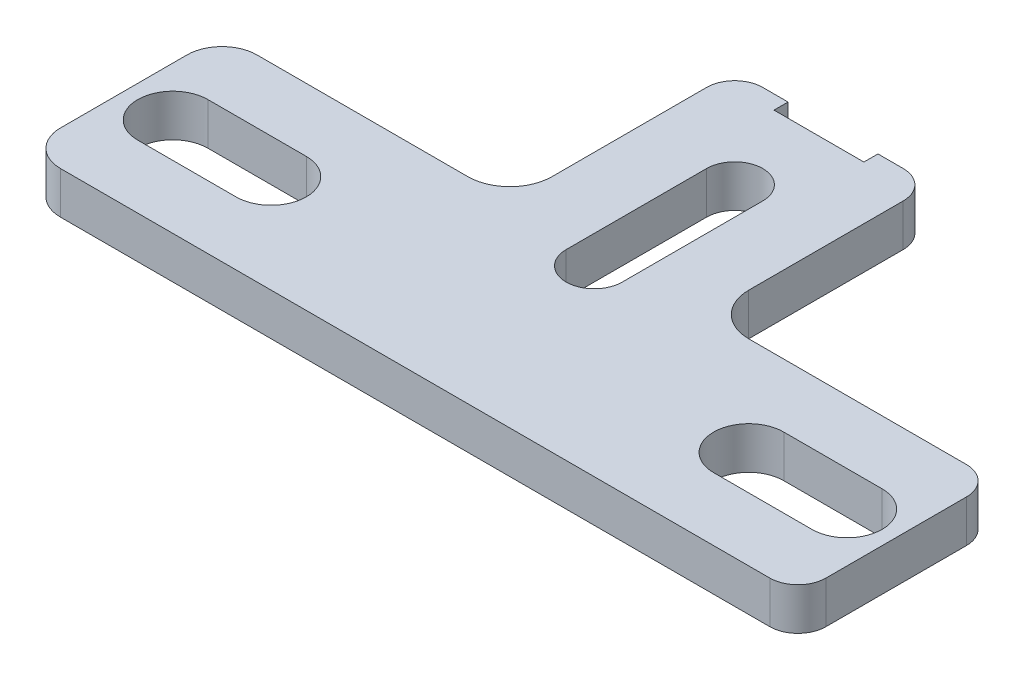
from build123d import *
from OCP.BRepFilletAPI import BRepFilletAPI_MakeFillet

# Parameters (mm, degrees)
SKETCH1_W           = 55
SKETCH1_H           = 30
BOSS_EXTRUDE1_DEPTH = 3
CUT_EXTRUDE1_DEPTH  = 32.468237955
SKETCH3_W           = 6.4
SKETCH3_H           = 2
CUT_EXTRUDE2_DEPTH  = 32.468237955
SKETCH4_W           = 20.5
SKETCH4_H           = 16
CUT_EXTRUDE3_DEPTH  = 32.468237955
FILLET1_R1          = 3
FILLET1_R2          = 2.5
FILLET1_R3          = 2


with BuildPart() as part:
    # Sketch1 → Boss-Extrude1 (new body)
    with BuildSketch(Plane(origin=(0, 0, 0), x_dir=(1, 0, 0), z_dir=(0, 1, 0))):
        Rectangle(SKETCH1_W, SKETCH1_H)
    extrude(amount=BOSS_EXTRUDE1_DEPTH)

    # Sketch2 → Cut-Extrude1 (cut, through all)
    with BuildSketch(Plane(origin=(0, 3, 0), x_dir=(1, 0, 0), z_dir=(0, 1, 0))):
        with BuildLine():
            Line((17, -5.5), (24, -5.5))
            ThreePointArc((24, -5.5), (26.5, -8), (24, -10.5))
            Line((24, -10.5), (17, -10.5))
            ThreePointArc((17, -10.5), (14.5, -8), (17, -5.5))
        make_face()
        with BuildLine():
            Line((-17, -5.5), (-24, -5.5))
            ThreePointArc((-24, -5.5), (-26.5, -8), (-24, -10.5))
            Line((-24, -10.5), (-17, -10.5))
            ThreePointArc((-17, -10.5), (-14.5, -8), (-17, -5.5))
        make_face()
        with BuildLine():
            Line((-2, -2), (-2, 8))
            ThreePointArc((-2, 8), (0, 10), (2, 8))
            Line((2, 8), (2, -2))
            ThreePointArc((2, -2), (0, -4), (-2, -2))
        make_face()
    extrude(amount=-CUT_EXTRUDE1_DEPTH, mode=Mode.SUBTRACT)

    # Sketch3 → Cut-Extrude2 (cut, through all)
    with BuildSketch(Plane(origin=(0, 3, 0), x_dir=(1, 0, 0), z_dir=(0, 1, 0))):
        with Locations((0, 15)):
            Rectangle(SKETCH3_W, SKETCH3_H)
    extrude(amount=-CUT_EXTRUDE2_DEPTH, mode=Mode.SUBTRACT)

    # Sketch4 → Cut-Extrude3 (cut, through all)
    with BuildSketch(Plane(origin=(0, 3, 0), x_dir=(1, 0, 0), z_dir=(0, 1, 0))):
        with Locations((-17.25, 7)):
            Rectangle(SKETCH4_W, SKETCH4_H)
        with Locations((17.25, 7)):
            Rectangle(SKETCH4_W, SKETCH4_H)
    extrude(amount=-CUT_EXTRUDE3_DEPTH, mode=Mode.SUBTRACT)

    # Fillet1: one fillet with a radius per group of edges: ONE call of the kernel's fillet builder (fillet() takes one radius for all edges)
    fillet1_edges_1 = [part.edges().sort_by_distance(p)[0] for p in [
        (7, 1.5, 1),
        (-7, 1.5, 1),
    ]]
    fillet1_edges_2 = [part.edges().sort_by_distance(p)[0] for p in [
        (-27.5, 1.5, 1),
        (-27.5, 1.5, 15),
    ]]
    fillet1_edges_3 = [part.edges().sort_by_distance(p)[0] for p in [
        (27.5, 1.5, 1),
        (27.5, 1.5, 15),
        (7, 1.5, -15),
        (-7, 1.5, -15),
    ]]
    fillet1 = BRepFilletAPI_MakeFillet(part.part.solid().wrapped)
    for e in fillet1_edges_1:
        fillet1.Add(FILLET1_R1, e.wrapped)
    for e in fillet1_edges_2:
        fillet1.Add(FILLET1_R2, e.wrapped)
    for e in fillet1_edges_3:
        fillet1.Add(FILLET1_R3, e.wrapped)
    add(Compound.cast(fillet1.Shape()), mode=Mode.REPLACE)


solid = part.part
